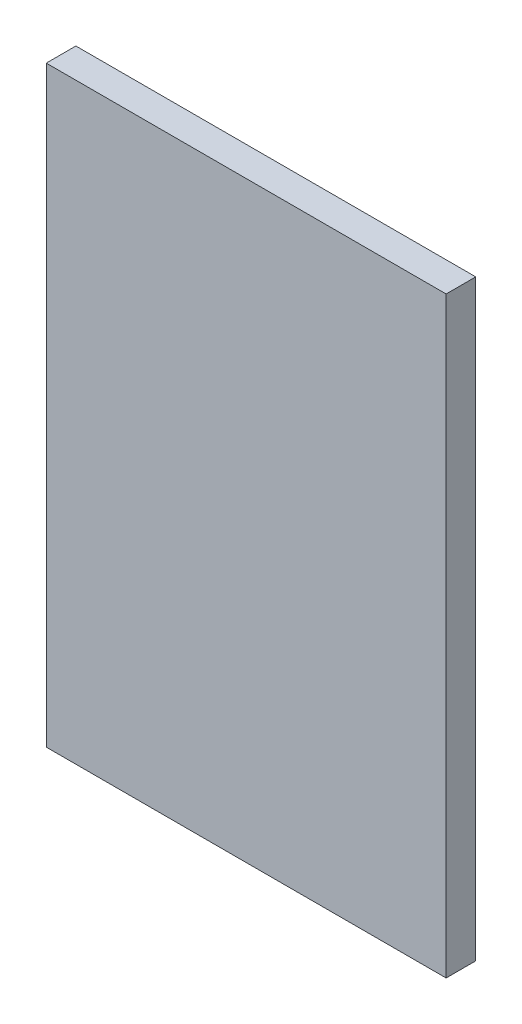
from build123d import *

# Parameters (mm, degrees)
SKCAJASUJETADORANORTE_W   = 270
SKCAJASUJETADORANORTE_H   = 20
CAJASUJETADORANORTE_DEPTH = 400


with BuildPart() as part:
    # SkCajaSujetadoraNorte → CajaSujetadoraNorte (new body)
    with BuildSketch(Plane(origin=(0, 630, 0), x_dir=(1, 0, 0), z_dir=(0, 1, 0))):
        with Locations((0, -145)):
            Rectangle(SKCAJASUJETADORANORTE_W, SKCAJASUJETADORANORTE_H)
    extrude(amount=CAJASUJETADORANORTE_DEPTH)


solid = part.part
